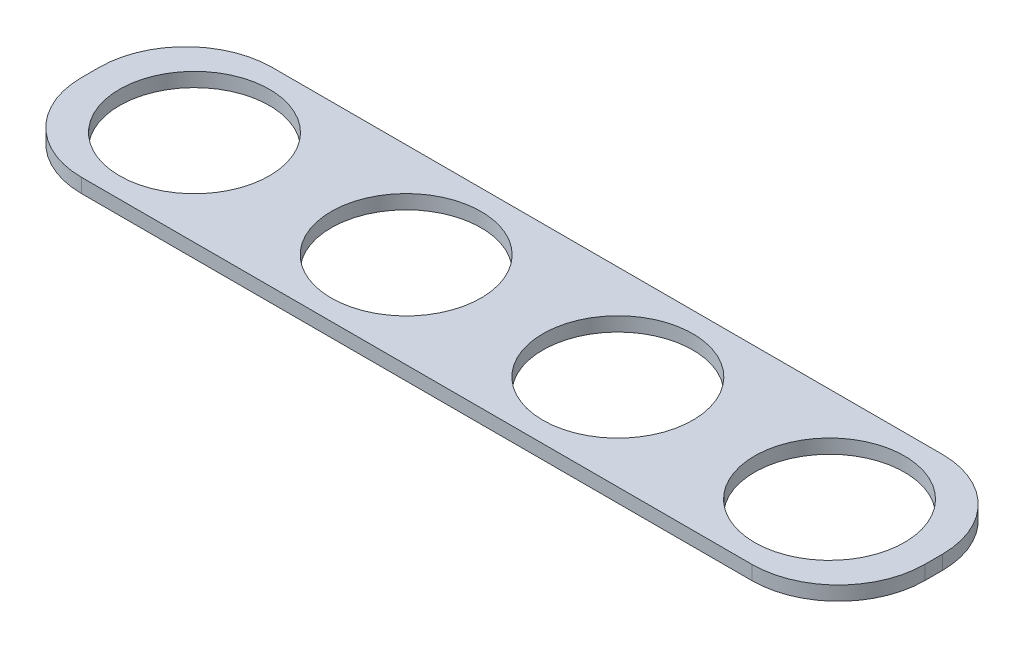
from build123d import *

# Parameters (mm, degrees)
SKETCH1_W           = 47.8
SKETCH1_H           = 10.8
BOSS_EXTRUDE1_DEPTH = 0.8
CUT_EXTRUDE1_REACH  = 26.516
SKETCH2_R           = 4.25
FILLET1_R           = 4.9


with BuildPart() as part:
    # Sketch1 → Boss-Extrude1 (new body)
    with BuildSketch(Plane(origin=(0, 0, 0), x_dir=(1, 0, 0), z_dir=(0, 1, 0))):
        Rectangle(SKETCH1_W, SKETCH1_H)
    extrude(amount=BOSS_EXTRUDE1_DEPTH)

    # Sketch2 → Cut-Extrude1 (cut, up to next)
    with BuildSketch(Plane(origin=(0, 0.8, 0), x_dir=(1, 0, 0), z_dir=(0, 1, 0)), mode=Mode.PRIVATE) as cut_extrude1_sk1:
        with Locations(Location((-18, 0, 0), (0, 0, 270))):
            Circle(SKETCH2_R)
    cut_extrude1_tool1 = extrude(cut_extrude1_sk1.sketch, amount=-CUT_EXTRUDE1_REACH, mode=Mode.PRIVATE) & part.part
    # Sketch2 → Cut-Extrude1 (cut, up to next)
    with BuildSketch(Plane(origin=(0, 0.8, 0), x_dir=(1, 0, 0), z_dir=(0, 1, 0)), mode=Mode.PRIVATE) as cut_extrude1_sk2:
        with Locations(Location((18, 0, 0), (0, 0, 270))):
            Circle(SKETCH2_R)
    cut_extrude1_tool2 = extrude(cut_extrude1_sk2.sketch, amount=-CUT_EXTRUDE1_REACH, mode=Mode.PRIVATE) & part.part
    # Sketch2 → Cut-Extrude1 (cut, up to next)
    with BuildSketch(Plane(origin=(0, 0.8, 0), x_dir=(1, 0, 0), z_dir=(0, 1, 0)), mode=Mode.PRIVATE) as cut_extrude1_sk3:
        with Locations(Location((-6, 0, 0), (0, 0, 270))):
            Circle(SKETCH2_R)
    cut_extrude1_tool3 = extrude(cut_extrude1_sk3.sketch, amount=-CUT_EXTRUDE1_REACH, mode=Mode.PRIVATE) & part.part
    # Sketch2 → Cut-Extrude1 (cut, up to next)
    with BuildSketch(Plane(origin=(0, 0.8, 0), x_dir=(1, 0, 0), z_dir=(0, 1, 0)), mode=Mode.PRIVATE) as cut_extrude1_sk4:
        with Locations(Location((6, 0, 0), (0, 0, 270))):
            Circle(SKETCH2_R)
    cut_extrude1_tool4 = extrude(cut_extrude1_sk4.sketch, amount=-CUT_EXTRUDE1_REACH, mode=Mode.PRIVATE) & part.part
    add(cut_extrude1_tool1.solids().sort_by_distance((-18, 0.8, 0))[0], mode=Mode.SUBTRACT)
    add(cut_extrude1_tool2.solids().sort_by_distance((18, 0.8, 0))[0], mode=Mode.SUBTRACT)
    add(cut_extrude1_tool3.solids().sort_by_distance((-6, 0.8, 0))[0], mode=Mode.SUBTRACT)
    add(cut_extrude1_tool4.solids().sort_by_distance((6, 0.8, 0))[0], mode=Mode.SUBTRACT)

    # Fillet1
    fillet1_edges = [part.edges().sort_by_distance(p)[0] for p in [
        (-23.9, 0.4, -5.4),
        (23.9, 0.4, -5.4),
        (23.9, 0.4, 5.4),
        (-23.9, 0.4, 5.4),
    ]]
    fillet(fillet1_edges, radius=FILLET1_R)


solid = part.part
